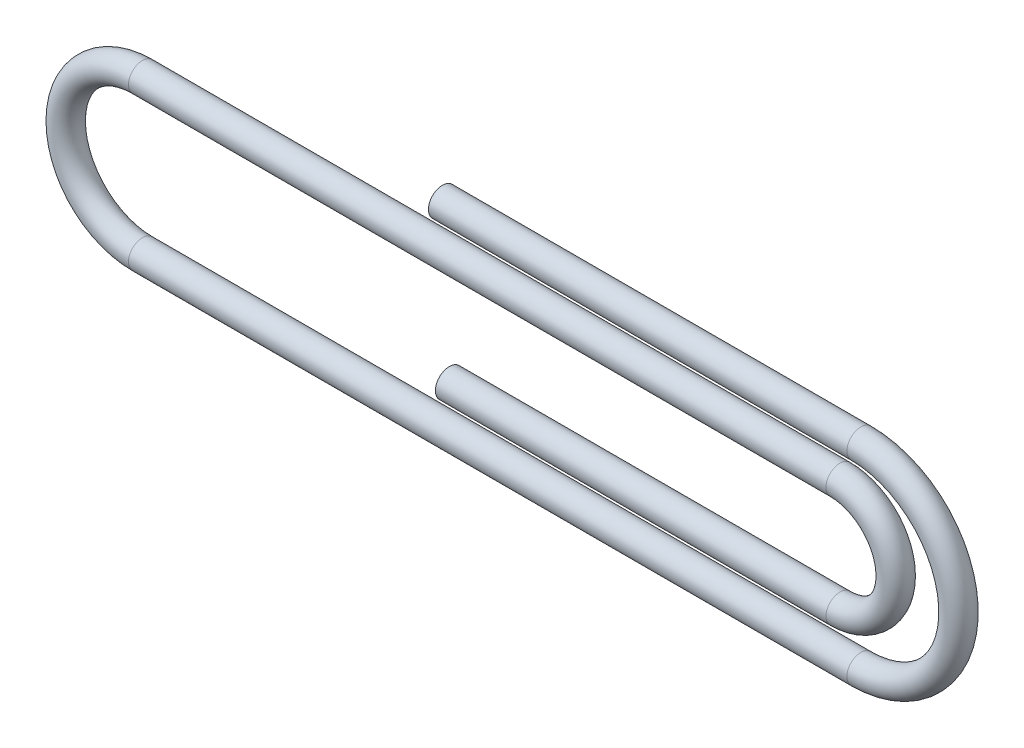
from build123d import *

# Parameters (mm, degrees)
SKETCH2_R = 0.5


with BuildPart() as part:
    # Sweep1: sweep along a path in Sketch1
    with BuildLine(Plane.XY) as sweep1_path:
        Line((0, 0), (15, 0))
        ThreePointArc((15, 0), (18.5, -3.5), (15, -7))
        Line((15, -7), (-10.75, -7))
        ThreePointArc((-10.75, -7), (-13.5, -4.25), (-10.75, -1.5))
        Line((-10.75, -1.5), (14.25, -1.5))
        ThreePointArc((14.25, -1.5), (16.25, -3.5), (14.25, -5.5))
        Line((14.25, -5.5), (0.25, -5.5))
    # Sketch2 → Sweep1 (sweep)
    with BuildSketch(Plane(origin=(0, 0, 0), x_dir=(0, 0, -1), z_dir=(1, 0, 0))):
        Circle(SKETCH2_R)
    sweep(path=sweep1_path.line)


solid = part.part
